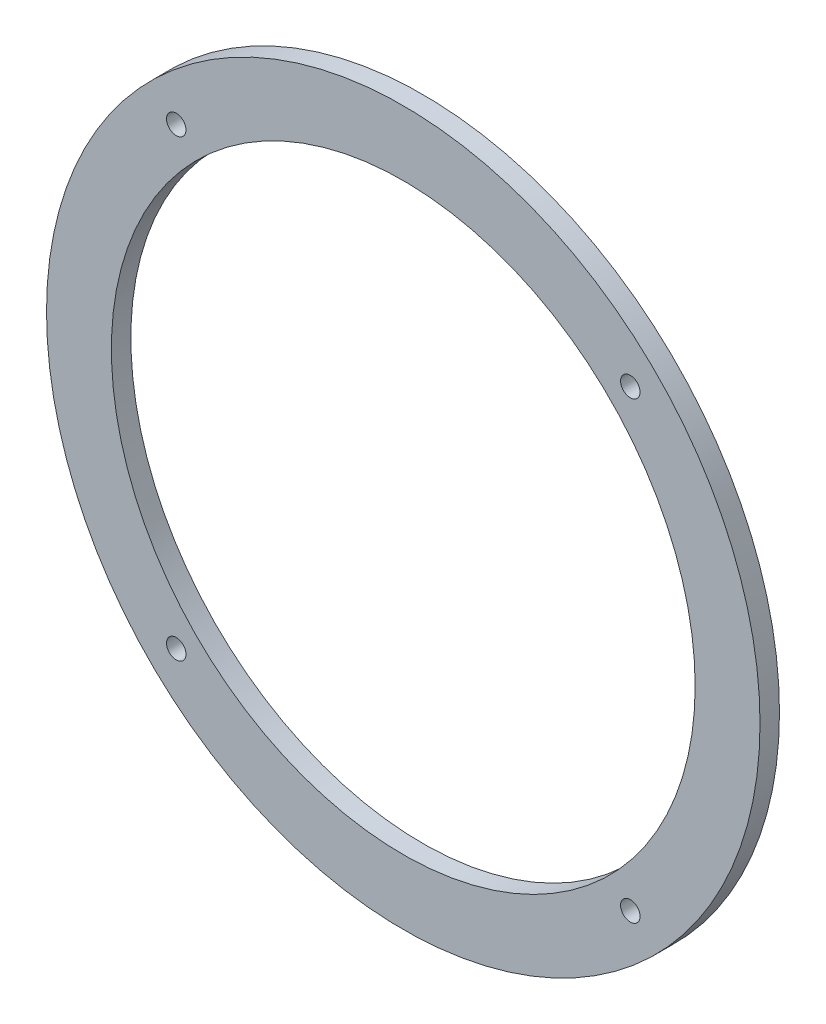
from build123d import *

# Parameters (mm, degrees)
SKETCH_1_R      = 55
SKETCH_1_R_2    = 45
SKETCH_1_R_3    = 1.5
EXTRUDE_1_DEPTH = 3


with BuildPart() as part:
    # 草图1 → 凸台-拉伸1 (new body)
    with BuildSketch(Plane.XY):
        Circle(SKETCH_1_R)
        Circle(SKETCH_1_R_2, mode=Mode.SUBTRACT)
        with Locations((-35, 35)):
            Circle(SKETCH_1_R_3, mode=Mode.SUBTRACT)
        with Locations((35, 35)):
            Circle(SKETCH_1_R_3, mode=Mode.SUBTRACT)
        with Locations((35, -35)):
            Circle(SKETCH_1_R_3, mode=Mode.SUBTRACT)
        with Locations((-35, -35)):
            Circle(SKETCH_1_R_3, mode=Mode.SUBTRACT)
    extrude(amount=EXTRUDE_1_DEPTH)


solid = part.part
